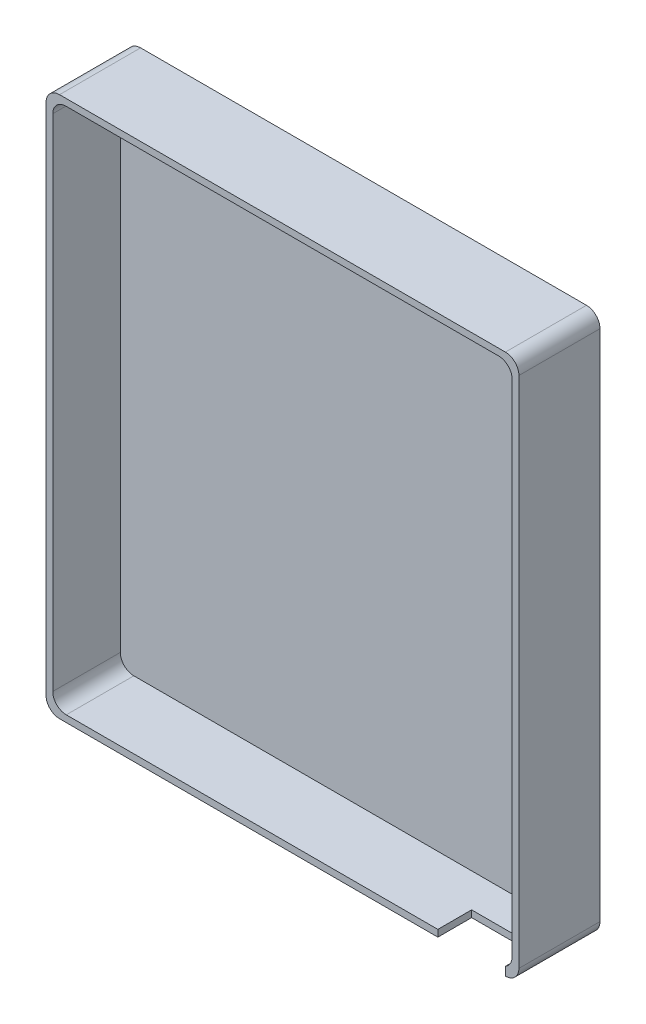
from build123d import *

# Parameters (mm, degrees)
BOSS_EXTRUDE2_DEPTH = 2.54
BOSS_EXTRUDE3_DEPTH = 15.24
SKETCH6_W           = 12.7
SKETCH6_H           = 6.35
CUT_EXTRUDE3_DEPTH  = 2.54


with BuildPart() as part:
    # Sketch1 → Boss-Extrude2 (new body)
    with BuildSketch(Plane.XY):
        with BuildLine():
            ThreePointArc((1.27, 3.81), (2.013948776, 2.013948776), (3.81, 1.27))
            Line((3.81, 1.27), (85.09, 1.27))
            ThreePointArc((85.09, 1.27), (86.886051224, 2.013948776), (87.63, 3.81))
            Line((87.63, 3.81), (87.63, 97.79))
            ThreePointArc((87.63, 97.79), (86.886051224, 99.586051224), (85.09, 100.33))
            Line((85.09, 100.33), (3.741384126, 100.33))
            ThreePointArc((3.741384126, 100.33), (1.993851652, 99.606148348), (1.27, 97.858615874))
            Line((1.27, 97.858615874), (1.27, 3.81))
        make_face()
    extrude(amount=BOSS_EXTRUDE2_DEPTH)

    # Sketch1<3> → Boss-Extrude3 (add)
    with BuildSketch(Plane.XY):
        with BuildLine():
            ThreePointArc((0, 2.54), (0.743948776, 0.743948776), (2.54, 0))
            Line((2.54, 0), (86.36, 0))
            ThreePointArc((86.36, 0), (88.156051224, 0.743948776), (88.9, 2.54))
            Line((88.9, 2.54), (88.9, 99.06))
            ThreePointArc((88.9, 99.06), (88.156051224, 100.856051224), (86.36, 101.6))
            Line((86.36, 101.6), (2.54, 101.6))
            ThreePointArc((2.54, 101.6), (0.743948776, 100.856051224), (0, 99.06))
            Line((0, 99.06), (0, 2.54))
        make_face()
        with BuildLine():
            Line((85.09, 1.27), (3.81, 1.27))
            ThreePointArc((3.81, 1.27), (2.013948776, 2.013948776), (1.27, 3.81))
            Line((1.27, 3.81), (1.27, 97.858615874))
            ThreePointArc((1.27, 97.858615874), (1.993851652, 99.606148348), (3.741384126, 100.33))
            Line((3.741384126, 100.33), (85.09, 100.33))
            ThreePointArc((85.09, 100.33), (86.886051224, 99.586051224), (87.63, 97.79))
            Line((87.63, 97.79), (87.63, 3.81))
            ThreePointArc((87.63, 3.81), (86.886051224, 2.013948776), (85.09, 1.27))
        make_face(mode=Mode.SUBTRACT)
    extrude(amount=BOSS_EXTRUDE3_DEPTH)

    # Sketch6 → Cut-Extrude3 (cut)
    with BuildSketch(Plane.XZ):
        with Locations((80.01, 12.065)):
            Rectangle(SKETCH6_W, SKETCH6_H)
    extrude(amount=-CUT_EXTRUDE3_DEPTH, mode=Mode.SUBTRACT)


solid = part.part
